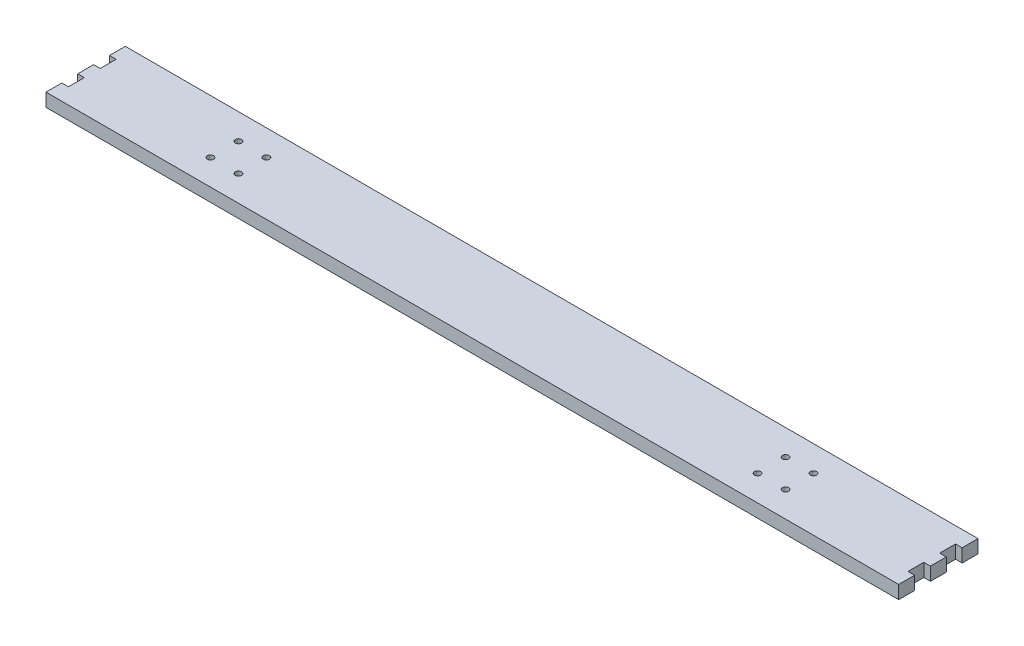
from build123d import *

# Parameters (mm, degrees)
SKETCH1_W           = 409.575
SKETCH1_H           = 38.1
BOSS_EXTRUDE1_DEPTH = 6.35
CUT_EXTRUDE1_REACH  = 207.77
SKETCH2_W           = 3.175
SKETCH2_H           = 7.62
CUT_EXTRUDE2_REACH  = 207.77
SKETCH3_R           = 1.5


with BuildPart() as part:
    # Sketch1 → Boss-Extrude1 (new body)
    with BuildSketch(Plane(origin=(0, 0, 0), x_dir=(1, 0, 0), z_dir=(0, 1, 0))):
        Rectangle(SKETCH1_W, SKETCH1_H)
    extrude(amount=BOSS_EXTRUDE1_DEPTH)

    # Sketch2 → Cut-Extrude1 (cut, up to next)
    with BuildSketch(Plane(origin=(0, 6.35, 0), x_dir=(1, 0, 0), z_dir=(0, 1, 0)), mode=Mode.PRIVATE) as cut_extrude1_sk1:
        with Locations((-203.2, 7.62)):
            Rectangle(SKETCH2_W, SKETCH2_H)
    cut_extrude1_tool1 = extrude(cut_extrude1_sk1.sketch, amount=-CUT_EXTRUDE1_REACH, mode=Mode.PRIVATE) & part.part
    # Sketch2 → Cut-Extrude1 (cut, up to next)
    with BuildSketch(Plane(origin=(0, 6.35, 0), x_dir=(1, 0, 0), z_dir=(0, 1, 0)), mode=Mode.PRIVATE) as cut_extrude1_sk2:
        with Locations((-203.2, -7.62)):
            Rectangle(SKETCH2_W, SKETCH2_H)
    cut_extrude1_tool2 = extrude(cut_extrude1_sk2.sketch, amount=-CUT_EXTRUDE1_REACH, mode=Mode.PRIVATE) & part.part
    cut_extrude1_1 = cut_extrude1_tool1.solids().sort_by_distance((-203.2, 6.35, -7.62))[0]
    add(cut_extrude1_1, mode=Mode.SUBTRACT)
    cut_extrude1_2 = cut_extrude1_tool2.solids().sort_by_distance((-203.2, 6.35, 7.62))[0]
    add(cut_extrude1_2, mode=Mode.SUBTRACT)
    cut_extrude1 = cut_extrude1_1 + cut_extrude1_2  # Cut-Extrude1 as one shape, for the pattern or mirror that repeats it

    # Mirror1: Cut-Extrude1 across plane
    add(cut_extrude1.mirror(Plane(origin=(0, 0, 0), x_dir=(0, 0, 1), z_dir=(1, 0, 0))), mode=Mode.SUBTRACT)

    # Sketch3 → Cut-Extrude2 (cut, up to next)
    with BuildSketch(Plane(origin=(0, 6.35, 0), x_dir=(1, 0, 0), z_dir=(0, 1, 0)), mode=Mode.PRIVATE) as cut_extrude2_sk1:
        with Locations(Location((-138.1125, 6.717514421, 0), (0, 0, 270))):
            Circle(SKETCH3_R)
    cut_extrude2_tool1 = extrude(cut_extrude2_sk1.sketch, amount=-CUT_EXTRUDE2_REACH, mode=Mode.PRIVATE) & part.part
    # Sketch3 → Cut-Extrude2 (cut, up to next)
    with BuildSketch(Plane(origin=(0, 6.35, 0), x_dir=(1, 0, 0), z_dir=(0, 1, 0)), mode=Mode.PRIVATE) as cut_extrude2_sk2:
        with Locations(Location((-138.1125, -6.717514421, 0), (0, 0, 270))):
            Circle(SKETCH3_R)
    cut_extrude2_tool2 = extrude(cut_extrude2_sk2.sketch, amount=-CUT_EXTRUDE2_REACH, mode=Mode.PRIVATE) & part.part
    # Sketch3 → Cut-Extrude2 (cut, up to next)
    with BuildSketch(Plane(origin=(0, 6.35, 0), x_dir=(1, 0, 0), z_dir=(0, 1, 0)), mode=Mode.PRIVATE) as cut_extrude2_sk3:
        with Locations(Location((-124.677471157, 6.717514421, 0), (0, 0, 270))):
            Circle(SKETCH3_R)
    cut_extrude2_tool3 = extrude(cut_extrude2_sk3.sketch, amount=-CUT_EXTRUDE2_REACH, mode=Mode.PRIVATE) & part.part
    # Sketch3 → Cut-Extrude2 (cut, up to next)
    with BuildSketch(Plane(origin=(0, 6.35, 0), x_dir=(1, 0, 0), z_dir=(0, 1, 0)), mode=Mode.PRIVATE) as cut_extrude2_sk4:
        with Locations(Location((-124.677471157, -6.717514421, 0), (0, 0, 270))):
            Circle(SKETCH3_R)
    cut_extrude2_tool4 = extrude(cut_extrude2_sk4.sketch, amount=-CUT_EXTRUDE2_REACH, mode=Mode.PRIVATE) & part.part
    cut_extrude2_1 = cut_extrude2_tool1.solids().sort_by_distance((-138.1125, 6.35, -6.717514))[0]
    add(cut_extrude2_1, mode=Mode.SUBTRACT)
    cut_extrude2_2 = cut_extrude2_tool2.solids().sort_by_distance((-138.1125, 6.35, 6.717514))[0]
    add(cut_extrude2_2, mode=Mode.SUBTRACT)
    cut_extrude2_3 = cut_extrude2_tool3.solids().sort_by_distance((-124.677471, 6.35, -6.717514))[0]
    add(cut_extrude2_3, mode=Mode.SUBTRACT)
    cut_extrude2_4 = cut_extrude2_tool4.solids().sort_by_distance((-124.677471, 6.35, 6.717514))[0]
    add(cut_extrude2_4, mode=Mode.SUBTRACT)
    cut_extrude2 = cut_extrude2_1 + cut_extrude2_2 + cut_extrude2_3 + cut_extrude2_4  # Cut-Extrude2 as one shape, for the pattern or mirror that repeats it

    # Mirror2: Cut-Extrude2 across plane
    add(cut_extrude2.mirror(Plane(origin=(0, 0, 0), x_dir=(0, 0, 1), z_dir=(1, 0, 0))), mode=Mode.SUBTRACT)


solid = part.part
